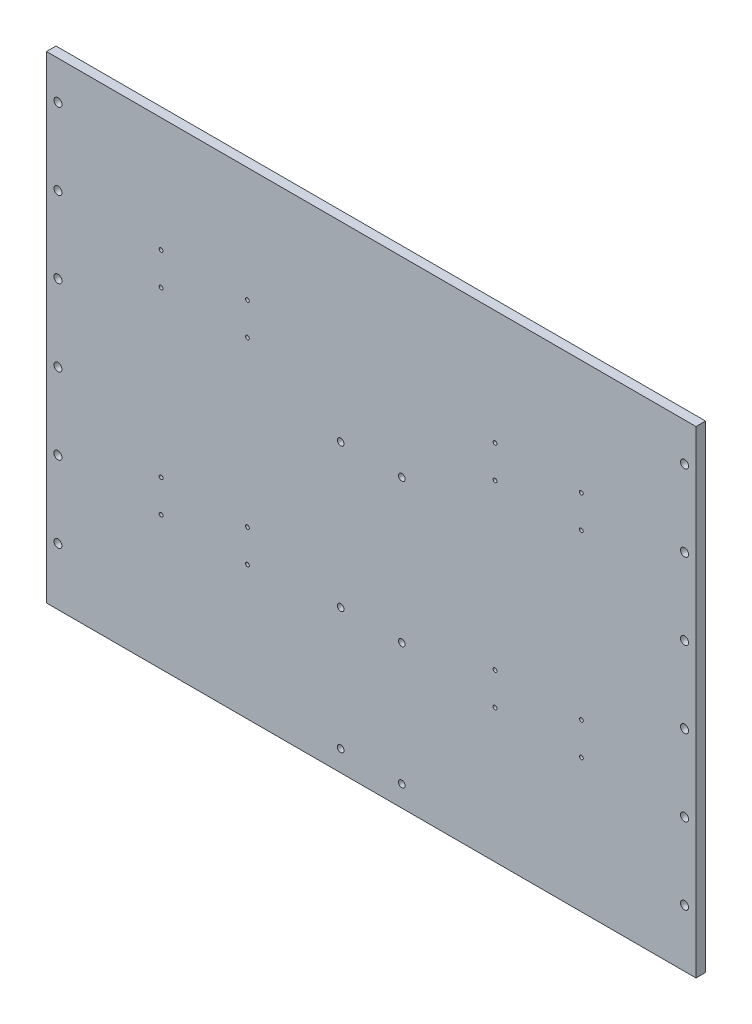
from build123d import *

# Parameters (mm, degrees)
SKETCH_1_R               = 1
SKETCH_1_R_2             = 1.75
EXTRUDE_1_DEPTH          = 5
SKETCH_2_R               = 2.1
CUT_EXTRUDE_1_DEPTH      = 10
MIRROR_2_COPY_1_SKETCH_R = 2.1
MIRROR_2_COPY_1_DEPTH    = 10


with BuildPart() as part:
    # 草图1 → 凸台-拉伸1 (new body)
    with BuildSketch(Plane.XY):
        Polygon((-170, -120), (-170, 120), (170, 120), (170, -120), (170, -130), (-170, -130), align=None)
        with Locations((-110, 60)):
            Circle(SKETCH_1_R, mode=Mode.SUBTRACT)
        with Locations((-64.8, 60)):
            Circle(SKETCH_1_R, mode=Mode.SUBTRACT)
        with Locations((-64.8, 43)):
            Circle(SKETCH_1_R, mode=Mode.SUBTRACT)
        with Locations((-110, 43)):
            Circle(SKETCH_1_R, mode=Mode.SUBTRACT)
        with Locations(Location((-110, -43, 0), (0, 0, 180))):
            Circle(SKETCH_1_R, mode=Mode.SUBTRACT)
        with Locations(Location((-64.8, -43, 0), (0, 0, 180))):
            Circle(SKETCH_1_R, mode=Mode.SUBTRACT)
        with Locations(Location((-64.8, -60, 0), (0, 0, 180))):
            Circle(SKETCH_1_R, mode=Mode.SUBTRACT)
        with Locations(Location((-110, -60, 0), (0, 0, 180))):
            Circle(SKETCH_1_R, mode=Mode.SUBTRACT)
        with Locations((110, -60)):
            Circle(SKETCH_1_R, mode=Mode.SUBTRACT)
        with Locations((64.8, -60)):
            Circle(SKETCH_1_R, mode=Mode.SUBTRACT)
        with Locations((64.8, -43)):
            Circle(SKETCH_1_R, mode=Mode.SUBTRACT)
        with Locations((110, -43)):
            Circle(SKETCH_1_R, mode=Mode.SUBTRACT)
        with Locations(Location((110, 43, 0), (0, 0, 180))):
            Circle(SKETCH_1_R, mode=Mode.SUBTRACT)
        with Locations(Location((64.8, 43, 0), (0, 0, 180))):
            Circle(SKETCH_1_R, mode=Mode.SUBTRACT)
        with Locations(Location((64.8, 60, 0), (0, 0, 180))):
            Circle(SKETCH_1_R, mode=Mode.SUBTRACT)
        with Locations(Location((110, 60, 0), (0, 0, 180))):
            Circle(SKETCH_1_R, mode=Mode.SUBTRACT)
        with Locations((-16, 20)):
            Circle(SKETCH_1_R_2, mode=Mode.SUBTRACT)
        with Locations(Location((16, 20, 0), (0, 0, 180))):
            Circle(SKETCH_1_R_2, mode=Mode.SUBTRACT)
        with Locations((16, -55)):
            Circle(SKETCH_1_R_2, mode=Mode.SUBTRACT)
        with Locations((16, -119)):
            Circle(SKETCH_1_R_2, mode=Mode.SUBTRACT)
        with Locations((-16, -55)):
            Circle(SKETCH_1_R_2, mode=Mode.SUBTRACT)
        with Locations((-16, -119)):
            Circle(SKETCH_1_R_2, mode=Mode.SUBTRACT)
    extrude(amount=EXTRUDE_1_DEPTH)

    # 草图2 → 切除-拉伸1 (cut)
    with BuildSketch(Plane.XY.offset(5)):
        with Locations((-164, 100)):
            Circle(SKETCH_2_R)
        with Locations((-164, 60)):
            Circle(SKETCH_2_R)
        with Locations((-164, 20)):
            Circle(SKETCH_2_R)
    cut_extrude_1 = extrude(amount=-CUT_EXTRUDE_1_DEPTH, mode=Mode.SUBTRACT)

    # 镜向1: 切除-拉伸1 across plane
    add(cut_extrude_1.mirror(Plane.ZX), mode=Mode.SUBTRACT)

    # 镜向2: 切除-拉伸1 across plane
    add(cut_extrude_1.mirror(Plane(origin=(0, 0, 0), x_dir=(0, 0, 1), z_dir=(1, 0, 0))), mode=Mode.SUBTRACT)

    # 镜向2 copy 1 sketch → 镜向2 copy 1 (cut)
    with BuildSketch(Plane(origin=(0, 0, 5), x_dir=(-1, 0, 0), z_dir=(0, 0, 1))):
        with Locations((-164, 100)):
            Circle(MIRROR_2_COPY_1_SKETCH_R)
        with Locations((-164, 60)):
            Circle(MIRROR_2_COPY_1_SKETCH_R)
        with Locations((-164, 20)):
            Circle(MIRROR_2_COPY_1_SKETCH_R)
    extrude(amount=-MIRROR_2_COPY_1_DEPTH, mode=Mode.SUBTRACT)


solid = part.part
